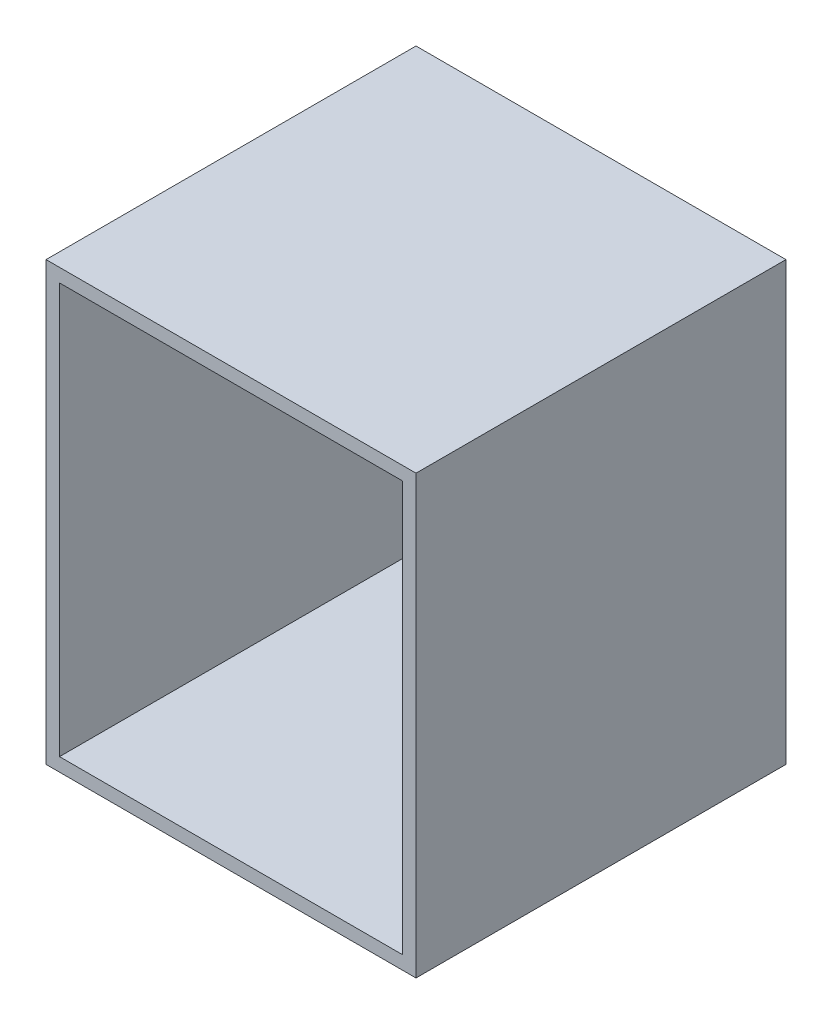
from build123d import *

# Parameters (mm, degrees)
SKETCH1_W           = 55
SKETCH1_H           = 65
BOSS_EXTRUDE1_DEPTH = 27.5
SHELL1_T            = -2
SKETCH2_W           = 51
SKETCH2_H           = 61
CUT_EXTRUDE1_DEPTH  = 68.981615162


with BuildPart() as part:
    # Sketch1 → Boss-Extrude1 (new, symmetric)
    with BuildSketch(Plane.XY):
        Rectangle(SKETCH1_W, SKETCH1_H)
    extrude(amount=BOSS_EXTRUDE1_DEPTH, both=True)

    # Shell1
    shell1_openings = [part.faces().sort_by_distance(p)[0] for p in [
        (0, 0, 27.5),
    ]]
    offset(amount=SHELL1_T, openings=shell1_openings, kind=Kind.INTERSECTION)

    # Sketch2 → Cut-Extrude1 (cut, through all)
    with BuildSketch(Plane.XY.offset(-25.5)):
        Rectangle(SKETCH2_W, SKETCH2_H)
    extrude(amount=-CUT_EXTRUDE1_DEPTH, mode=Mode.SUBTRACT)


solid = part.part
